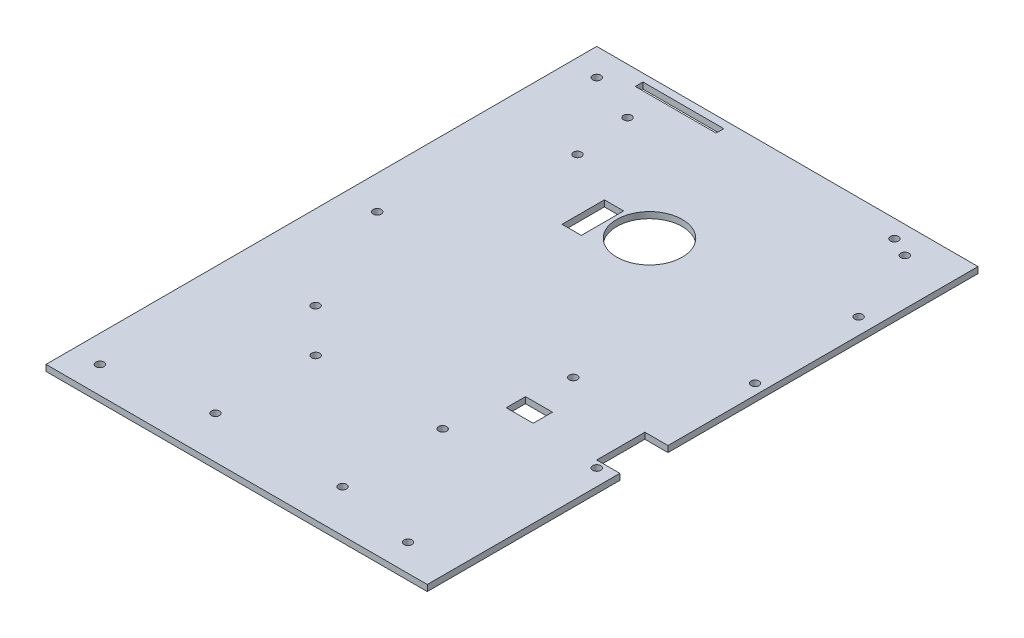
from build123d import *

# Parameters (mm, degrees)
SKETCH_1_R      = 1.05
SKETCH_1_W      = 7
SKETCH_1_H      = 5
SKETCH_1_W_2    = 5
SKETCH_1_H_2    = 11
SKETCH_1_W_3    = 21
SKETCH_1_H_3    = 2
SKETCH_1_R_2    = 8.5
EXTRUDE_1_DEPTH = 1.6


with BuildPart() as part:
    # 草图1 → 凸台-拉伸1 (new body)
    with BuildSketch(Plane(origin=(0, 0, 0), x_dir=(1, 0, 0), z_dir=(0, 1, 0))):
        Polygon((99, 0), (0, 0), (0, -143), (99, -143), (99, -93), (93, -93), (93, -80.5), (99, -80.5), align=None)
        with Locations(Location((21.8, -94.8, 0), (0, 0, 270))):
            Circle(SKETCH_1_R, mode=Mode.SUBTRACT)
        with Locations((73, -90.5)):
            Rectangle(SKETCH_1_W, SKETCH_1_H, mode=Mode.SUBTRACT)
        with Locations(Location((71.4, -77.5, 0), (0, 0, 270))):
            Circle(SKETCH_1_R, mode=Mode.SUBTRACT)
        with Locations(Location((94.8, -94.8, 0), (0, 0, 270))):
            Circle(SKETCH_1_R, mode=Mode.SUBTRACT)
        with Locations(Location((8.7, -65.7, 0), (0, 0, 270))):
            Circle(SKETCH_1_R, mode=Mode.SUBTRACT)
        with Locations((38, -39)):
            Rectangle(SKETCH_1_W_2, SKETCH_1_H_2, mode=Mode.SUBTRACT)
        with Locations(Location((21.8, -26.8, 0), (0, 0, 270))):
            Circle(SKETCH_1_R, mode=Mode.SUBTRACT)
        with Locations(Location((7, -7, 0), (0, 0, 270))):
            Circle(SKETCH_1_R, mode=Mode.SUBTRACT)
        with Locations(Location((20, -12, 0), (0, 0, 270))):
            Circle(SKETCH_1_R, mode=Mode.SUBTRACT)
        with Locations((24.5, -3)):
            Rectangle(SKETCH_1_W_3, SKETCH_1_H_3, mode=Mode.SUBTRACT)
        with Locations(Location((50, -36.3, 0), (0, 0, 270))):
            Circle(SKETCH_1_R_2, mode=Mode.SUBTRACT)
        with Locations(Location((96.3, -55.2, 0), (0, 0, 270))):
            Circle(SKETCH_1_R, mode=Mode.SUBTRACT)
        with Locations(Location((94.8, -26.8, 0), (0, 0, 270))):
            Circle(SKETCH_1_R, mode=Mode.SUBTRACT)
        with Locations(Location((81.9, -4.6, 0), (0, 0, 270))):
            Circle(SKETCH_1_R, mode=Mode.SUBTRACT)
        with Locations(Location((87, -7, 0), (0, 0, 270))):
            Circle(SKETCH_1_R, mode=Mode.SUBTRACT)
        with Locations(Location((66, -106, 0), (0, 0, 270))):
            Circle(SKETCH_1_R, mode=Mode.SUBTRACT)
        with Locations(Location((7, -136, 0), (0, 0, 270))):
            Circle(SKETCH_1_R, mode=Mode.SUBTRACT)
        with Locations(Location((33, -132, 0), (0, 0, 270))):
            Circle(SKETCH_1_R, mode=Mode.SUBTRACT)
        with Locations(Location((33, -106, 0), (0, 0, 270))):
            Circle(SKETCH_1_R, mode=Mode.SUBTRACT)
        with Locations(Location((66, -132, 0), (0, 0, 270))):
            Circle(SKETCH_1_R, mode=Mode.SUBTRACT)
        with Locations(Location((87, -136, 0), (0, 0, 270))):
            Circle(SKETCH_1_R, mode=Mode.SUBTRACT)
    extrude(amount=EXTRUDE_1_DEPTH)


solid = part.part
